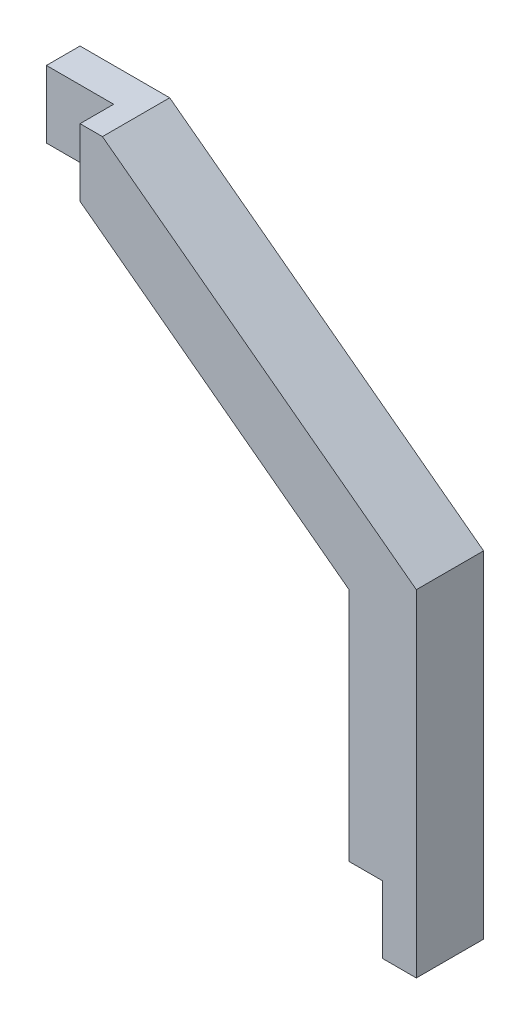
from build123d import *

# Parameters (mm, degrees)
SALIENTE_EXTRUIR1_DEPTH = 20
CROQUIS2_W              = 20
CROQUIS2_H              = 20
CORTAR_EXTRUIR1_DEPTH   = 10
CROQUIS3_W              = 20
CROQUIS3_H              = 20
CORTAR_EXTRUIR2_DEPTH   = 10


with BuildPart() as part:
    # Croquis1 → Saliente-Extruir1 (new body)
    with BuildSketch(Plane.XY):
        Polygon((-60, 0), (-33.333333333, 0), (60, -70), (60, -170), (40, -170), (40, -80), (-40, -20), (-60, -20), align=None)
    extrude(amount=SALIENTE_EXTRUIR1_DEPTH)

    # Croquis2 → Cortar-Extruir1 (cut)
    with BuildSketch(Plane.XY.offset(20)):
        with Locations((-50, -10)):
            Rectangle(CROQUIS2_W, CROQUIS2_H)
    extrude(amount=-CORTAR_EXTRUIR1_DEPTH, mode=Mode.SUBTRACT)

    # Croquis3 → Cortar-Extruir2 (cut)
    with BuildSketch(Plane(origin=(40, 0, 0), x_dir=(0, 0, -1), z_dir=(1, 0, 0))):
        with Locations((-10, -160)):
            Rectangle(CROQUIS3_W, CROQUIS3_H)
    extrude(amount=CORTAR_EXTRUIR2_DEPTH, mode=Mode.SUBTRACT)


solid = part.part
